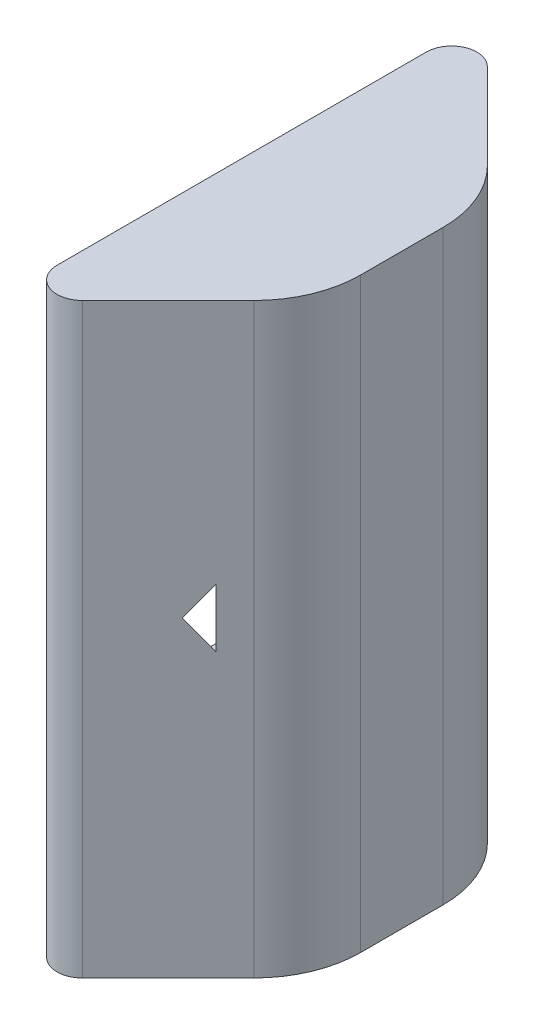
from build123d import *

# Parameters (mm, degrees)
BOSS_EXTRUDE1_START = 3
BOSS_EXTRUDE1_DEPTH = 8
CUT_EXTRUDE1_DEPTH  = 3


with BuildPart() as part:
    # Sketch1 → Boss-Extrude1 (new, symmetric)
    with BuildSketch(Plane(origin=(0, 887.368143731, 0), x_dir=(1, 0, 0), z_dir=(0, 1, 0)).offset(BOSS_EXTRUDE1_START)):
        with BuildLine():
            Line((637.813700875, -1272.18749392), (637.81370087, -1269.938359702))
            ThreePointArc((637.81370087, -1269.938359702), (637.592190309, -1268.824750917), (636.961381603, -1267.880678974))
            Line((636.961381603, -1267.880678974), (634.621604573, -1265.540901944))
            ThreePointArc((634.621604573, -1265.540901944), (633.86964944, -1265.391328698), (633.443700894, -1266.028805374))
            Line((633.443700894, -1266.028805374), (633.443700112, -1268.19792696))
            Line((633.443700112, -1268.19792696), (633.443700112, -1273.927926678))
            Line((633.443700112, -1273.927926678), (633.4437009, -1276.09704826))
            ThreePointArc((633.4437009, -1276.09704826), (633.869649447, -1276.734524935), (634.621604579, -1276.584951689))
            Line((634.621604579, -1276.584951689), (636.961381608, -1274.245174659))
            ThreePointArc((636.961381608, -1274.245174659), (637.592190316, -1273.301102712), (637.813700875, -1272.18749392))
        make_face()
    extrude(amount=BOSS_EXTRUDE1_DEPTH, both=True)

    # Sketch2 → Cut-Extrude1 (cut)
    with BuildSketch(Plane(origin=(633.443237581, 0, -0.000229987), x_dir=(3.630749913810974e-07, 0, 0.9999999999999342), z_dir=(-0.9999999999999342, 0, 3.630749913810974e-07))):
        Polygon((1268.987365094, 887.268143731), (1267.948134548, 889.068143719), (1266.908904124, 890.868143731), (1267.948134534, 892.668143718), (1268.987365094, 894.468143731), (1271.065825986, 894.468143731), (1273.144287032, 894.468143731), (1274.18351745, 892.668143728), (1275.222748001, 890.868143731), (1274.183517448, 889.068143728), (1273.144287032, 887.268143731), (1271.065825995, 887.268143731), align=None)
    extrude(amount=-CUT_EXTRUDE1_DEPTH, mode=Mode.SUBTRACT)


solid = part.part
